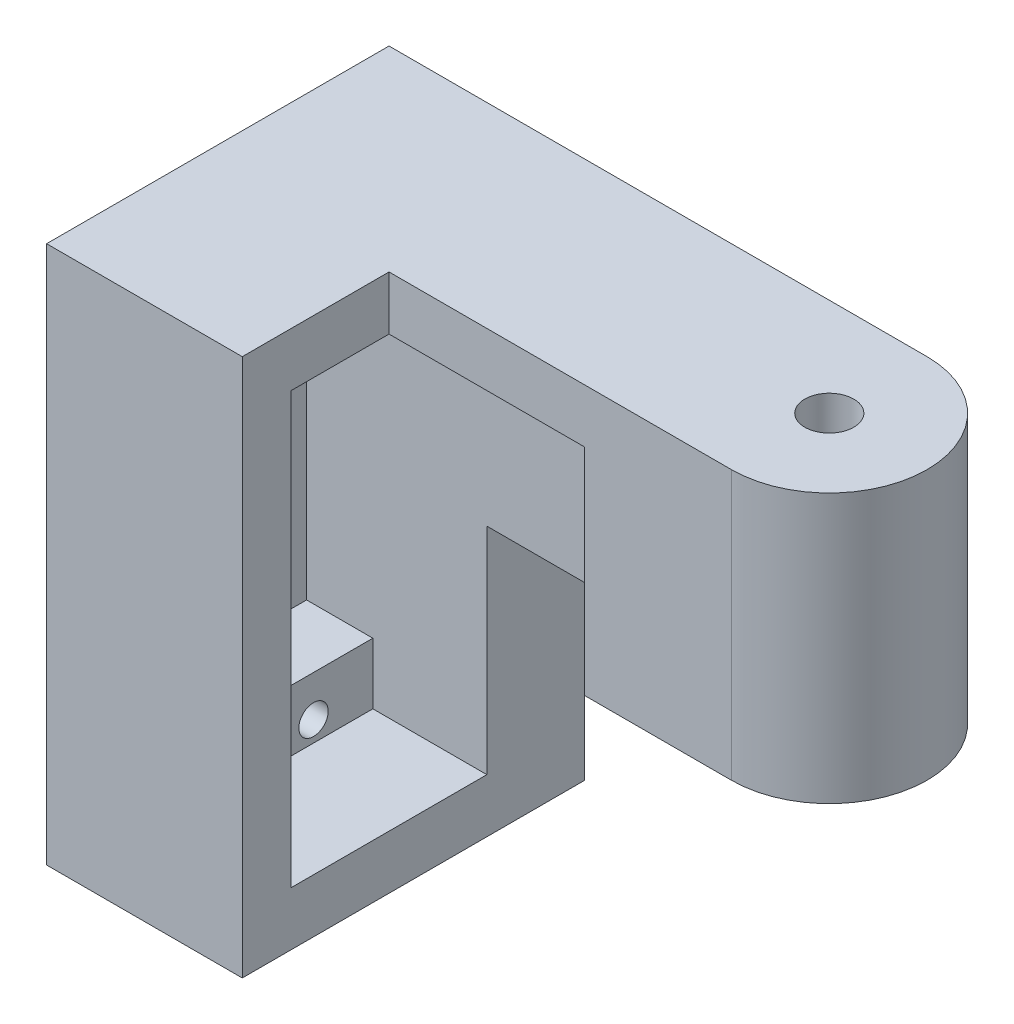
from build123d import *

# Parameters (mm, degrees)
SKETCH1_R                       = 19.05
SKETCH1_W                       = 152.4
SKETCH1_H                       = 38.1
BOSS_EXTRUDE1_DEPTH             = 25.4
SKETCH4_W                       = 25.4
SKETCH4_H                       = 69.85
BOSS_EXTRUDE3_DEPTH             = 19.05
BOSS_EXTRUDE3_DIRECTION_2_REACH = 102.402
SKETCH5_R                       = 6.985
SKETCH5_R_2                     = 1.905
CUT_EXTRUDE1_DEPTH              = 25.4
SKETCH13_W                      = 63.5
SKETCH13_H                      = 69.85
BOSS_EXTRUDE6_DEPTH             = 25.4
SKETCH7_W                       = 50.8
SKETCH7_H                       = 55.88
CUT_EXTRUDE2_DEPTH              = 25.4
SKETCH8_W                       = 25.4
SKETCH8_H                       = 39.99992
CUT_EXTRUDE3_DEPTH              = 23.400004
SKETCH9_W                       = 25.4
SKETCH9_H                       = 7.94004
CUT_EXTRUDE4_DEPTH              = 14.800072
SKETCH10_W                      = 2.54
SKETCH10_H                      = 7.94004
CUT_EXTRUDE5_DEPTH              = 8.599932
SKETCH11_R                      = 3.175
CUT_EXTRUDE6_DEPTH              = 109.664809851
BOSS_EXTRUDE7_DEPTH             = 55.88
CUT_EXTRUDE7_DEPTH              = 127.203753906
SKETCH16_W                      = 57.15
SKETCH16_H                      = 34.925
CUT_EXTRUDE8_DEPTH              = 93.422499425
SKETCH17_R                      = 3.175
CUT_EXTRUDE9_DEPTH              = 95.878860264


with BuildPart() as part:
    # Sketch1 → Boss-Extrude1 (new body)
    with BuildSketch(Plane.XY):
        with Locations((76.2, 0)):
            Circle(SKETCH1_R)
        Rectangle(SKETCH1_W, SKETCH1_H)
    extrude(amount=BOSS_EXTRUDE1_DEPTH)

    # Sketch4 → Boss-Extrude3 (add)
    with BuildSketch(Plane.XY.offset(25.4)):
        with Locations((-63.5, 10.795)):
            Rectangle(SKETCH4_W, SKETCH4_H)
    extrude(amount=BOSS_EXTRUDE3_DEPTH)

    # Boss-Extrude3 direction 2: up to this face of the body (flat: up to its plane)
    boss_extrude3_direction_2_end = Plane(part.part.faces().sort_by_distance((7.534927708, 0, 0))[0])
    # Sketch4 → Boss-Extrude3 direction 2 (add, up to the picked face)
    with BuildSketch(Plane.XY.offset(25.4), mode=Mode.PRIVATE) as boss_extrude3_direction_2_sk1:
        with Locations((-63.5, 10.795)):
            Rectangle(SKETCH4_W, SKETCH4_H)
    boss_extrude3_direction_2_tool1 = split(extrude(boss_extrude3_direction_2_sk1.sketch, amount=-BOSS_EXTRUDE3_DIRECTION_2_REACH, mode=Mode.PRIVATE), bisect_by=boss_extrude3_direction_2_end, keep=Keep.BOTH, mode=Mode.PRIVATE)
    add(boss_extrude3_direction_2_tool1.solids().sort_by(Axis((-63.5, 10.795, 25.4), (0, 0, -1)))[0])

    # Sketch5 → Cut-Extrude1 (cut)
    with BuildSketch(Plane.ZY.offset(76.2)):
        with Locations((25.4, 0)):
            Circle(SKETCH5_R)
        with Locations((30.39999, -14.500098)):
            Circle(SKETCH5_R_2)
        with Locations((30.39999, 34.499804)):
            Circle(SKETCH5_R_2)
        with Locations(Location((20.40001, 34.499804, 0), (0, 0, 90))):
            Circle(SKETCH5_R_2)
        with Locations(Location((20.40001, -14.500098, 0), (0, 0, 90))):
            Circle(SKETCH5_R_2)
    extrude(amount=-CUT_EXTRUDE1_DEPTH, mode=Mode.SUBTRACT)

    # Sketch13 → Boss-Extrude6 (add)
    with BuildSketch(Plane.XY.offset(25.4)):
        with Locations((-19.05, 10.795)):
            Rectangle(SKETCH13_W, SKETCH13_H)
    extrude(amount=-BOSS_EXTRUDE6_DEPTH)

    # Sketch7 → Cut-Extrude2 (cut)
    with BuildSketch(Plane.XY.offset(25.4)):
        with Locations((-25.4, 10.795)):
            Rectangle(SKETCH7_W, SKETCH7_H)
    extrude(amount=-CUT_EXTRUDE2_DEPTH, mode=Mode.SUBTRACT)

    # Sketch8 → Cut-Extrude3 (cut)
    with BuildSketch(Plane(origin=(-50.8, 0, 0), x_dir=(0, 0, -1), z_dir=(1, 0, 0))):
        with Locations((-25.4, 10.795)):
            Rectangle(SKETCH8_W, SKETCH8_H)
    extrude(amount=-CUT_EXTRUDE3_DEPTH, mode=Mode.SUBTRACT)

    # Sketch9 → Cut-Extrude4 (cut)
    with BuildSketch(Plane(origin=(-50.8, 0, 0), x_dir=(0, 0, -1), z_dir=(1, 0, 0))):
        with Locations((-25.4, 34.76498)):
            Rectangle(SKETCH9_W, SKETCH9_H)
        with Locations((-25.4, -13.17498)):
            Rectangle(SKETCH9_W, SKETCH9_H)
    extrude(amount=-CUT_EXTRUDE4_DEPTH, mode=Mode.SUBTRACT)

    # Sketch10 → Cut-Extrude5 (cut)
    with BuildSketch(Plane(origin=(-65.600072, 0, 0), x_dir=(0, 0, -1), z_dir=(1, 0, 0))):
        with Locations((-25.4, -13.17498)):
            Rectangle(SKETCH10_W, SKETCH10_H)
        with Locations((-25.4, 34.76498)):
            Rectangle(SKETCH10_W, SKETCH10_H)
    extrude(amount=-CUT_EXTRUDE5_DEPTH, mode=Mode.SUBTRACT)

    # Sketch11 → Cut-Extrude6 (cut, through all)
    with BuildSketch(Plane.XY.offset(25.4)):
        with Locations((76.2, 0)):
            Circle(SKETCH11_R)
    extrude(amount=-CUT_EXTRUDE6_DEPTH, mode=Mode.SUBTRACT)

    # Sketch14 → Boss-Extrude7 (add)
    with BuildSketch(Plane(origin=(0, -17.145, 0), x_dir=(1, 0, 0), z_dir=(0, 1, 0))):
        Polygon((-50.8, -12.7), (-25.4, -12.7), (-25.4, -25.4), (0, -25.4), (0, 0), (-50.8, 0), align=None)
    extrude(amount=BOSS_EXTRUDE7_DEPTH)

    # Sketch15 → Cut-Extrude7 (cut, through all)
    with BuildSketch(Plane(origin=(0, 45.72, 0), x_dir=(1, 0, 0), z_dir=(0, 1, 0))):
        with BuildLine():
            Line((-6.35, 0), (95.25, 0))
            Line((95.25, 0), (95.25, -25.4))
            Line((95.25, -25.4), (-6.35, -25.4))
            ThreePointArc((-6.35, -25.4), (6.35, -12.7), (-6.35, 0))
        make_face()
    extrude(amount=-CUT_EXTRUDE7_DEPTH, mode=Mode.SUBTRACT)

    # Sketch16 → Cut-Extrude8 (cut, through all)
    with BuildSketch(Plane.XY.offset(25.4)):
        with Locations((-22.225, -6.6675)):
            Rectangle(SKETCH16_W, SKETCH16_H)
    extrude(amount=-CUT_EXTRUDE8_DEPTH, mode=Mode.SUBTRACT)

    # Sketch17 → Cut-Extrude9 (cut, through all)
    with BuildSketch(Plane.XZ.offset(-10.795)):
        with Locations(Location((-6.35, 12.7, 0), (0, 0, 270))):
            Circle(SKETCH17_R)
    extrude(amount=-CUT_EXTRUDE9_DEPTH, mode=Mode.SUBTRACT)


solid = part.part
